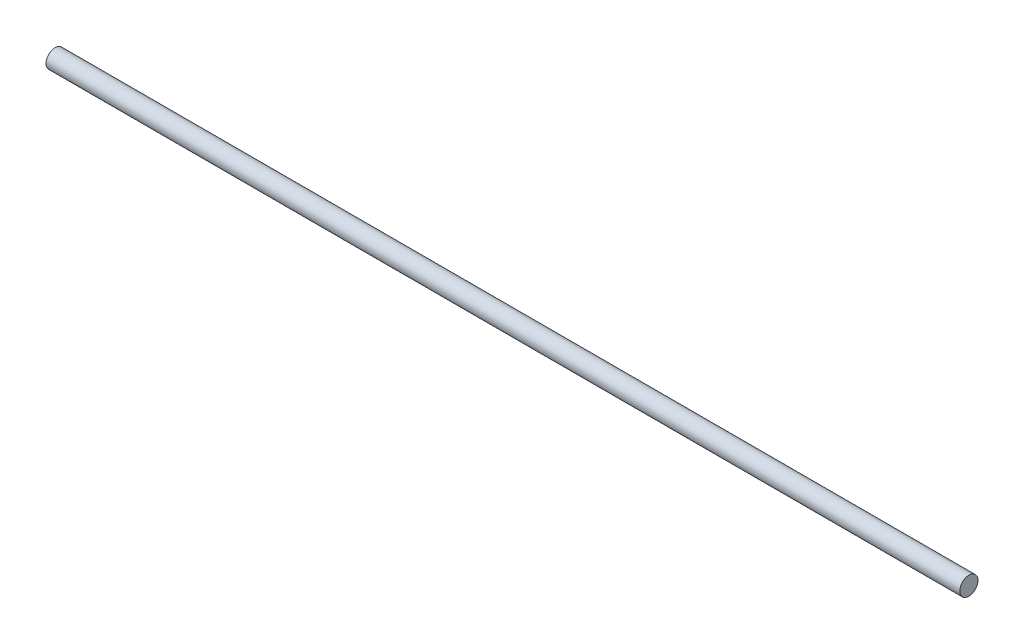
from build123d import *

# Parameters (mm, degrees)
SKETCH1_R           = 6.35
BOSS_EXTRUDE1_DEPTH = 635
SCALE1_SCALE        = 1.5


with BuildPart() as part:
    # Sketch1 → Boss-Extrude1 (new body)
    with BuildSketch(Plane(origin=(0, 0, 0), x_dir=(0, 0, -1), z_dir=(1, 0, 0))):
        with Locations(Location((0, 0, 0), (0, 0, 180))):
            Circle(SKETCH1_R)
    extrude(amount=BOSS_EXTRUDE1_DEPTH)


with BuildPart() as part_1:
    # Scale1: scaled about (317.5, 0, 0)
    add(part.part.scale(SCALE1_SCALE).moved(Location((-158.75, 0, 0))))


solid = part_1.part
